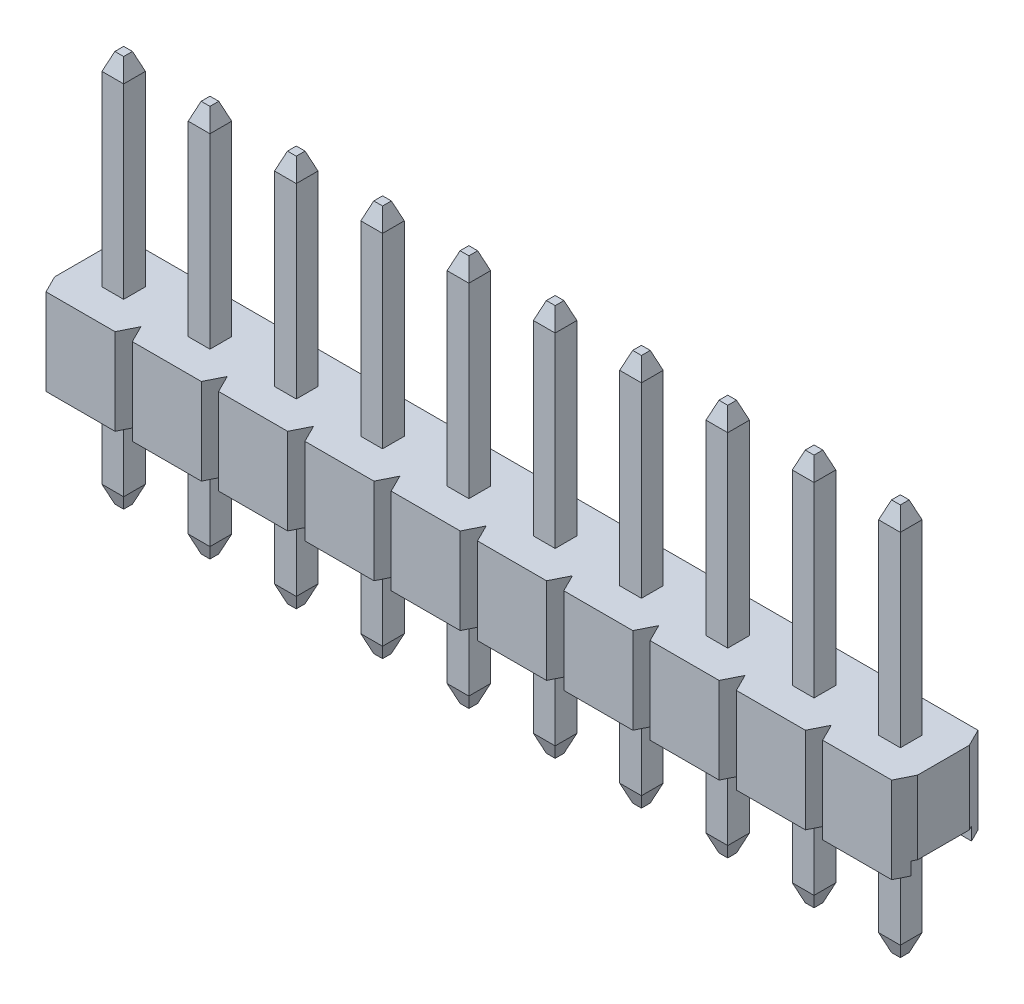
from build123d import *
from OCP.BRepFilletAPI import BRepFilletAPI_MakeChamfer

# Parameters (mm, degrees)
SKETCH1_W                     = 2.54
SKETCH1_H                     = 2.54
MAIN_BODY_DEPTH               = 2.54
SKETCH3_W                     = 1.778
SKETCH3_H                     = 0.381
CUT_EXTRUDE1_DEPTH            = 5.399409051
CUT_EXTRUDE2_DEPTH            = 5.399409051
BODY_PATTERN_COUNT            = 10
BODY_PATTERN_PITCH            = 2.54
PIN_START                     = -5.54
SKETCH2_W                     = 0.64
SKETCH2_H                     = 0.64
PIN_DEPTH                     = 11.54
CHAMFER1_SIZE                 = 0.508
CHAMFER1_SIZE2                = 0.1905
CHAMFER2_SIZE                 = 0.1905
CHAMFER2_SIZE2                = 0.508
PIN_PATTERN_COUNT             = 10
PIN_PATTERN_PITCH             = 2.54
CHAMFER1_OF_PIN_PATTERN_SIZE  = 0.508
CHAMFER1_OF_PIN_PATTERN_SIZE2 = 0.1905
CHAMFER2_OF_PIN_PATTERN_SIZE2 = 0.1905
CHAMFER2_OF_PIN_PATTERN_SIZE  = 0.508


with BuildPart() as part:
    # Sketch1 → Main Body (new body)
    with BuildSketch(Plane(origin=(0, 0, 0), x_dir=(1, 0, 0), z_dir=(0, 1, 0))):
        with Locations((1.27, 1.27)):
            Rectangle(SKETCH1_W, SKETCH1_H)
    main_body = extrude(amount=MAIN_BODY_DEPTH)

    # Sketch3 → Cut-Extrude1 (cut, through all)
    with BuildSketch(Plane.ZY):
        with Locations((-1.27, 0.1905)):
            Rectangle(SKETCH3_W, SKETCH3_H)
    cut_extrude1 = extrude(amount=-CUT_EXTRUDE1_DEPTH, mode=Mode.SUBTRACT)

    # Sketch4 → Cut-Extrude2 (cut, through all)
    with BuildSketch(Plane(origin=(0, 2.54, 0), x_dir=(1, 0, 0), z_dir=(0, 1, 0))):
        Polygon((0.254, 2.54), (0, 2.54), (0, 2.032), align=None)
        Polygon((2.54, 2.54), (2.286, 2.54), (2.54, 2.032), align=None)
        Polygon((0.254, 0), (0, 0.508), (0, 0), align=None)
        Polygon((2.54, 0), (2.286, 0), (2.54, 0.508), align=None)
    cut_extrude2 = extrude(amount=-CUT_EXTRUDE2_DEPTH, mode=Mode.SUBTRACT)

    # Body Pattern: Main Body, Cut-Extrude1, Cut-Extrude2 ×10
    with Locations(*[(-i * BODY_PATTERN_PITCH, 0, 0) for i in range(1, BODY_PATTERN_COUNT)]):
        add(main_body)
        add(cut_extrude1, mode=Mode.SUBTRACT)
        add(cut_extrude2, mode=Mode.SUBTRACT)

    # Sketch2 → Pin (add)
    with BuildSketch(Plane(origin=(0, 2.54, 0), x_dir=(1, 0, 0), z_dir=(0, 1, 0)).offset(PIN_START)):
        with Locations((1.27, 1.27)):
            Rectangle(SKETCH2_W, SKETCH2_H)
    pin = extrude(amount=PIN_DEPTH)

    # Chamfer1: one chamfer whose edges measure the first distance from different faces: ONE call of the kernel's chamfer builder (chamfer() names one face for all edges)
    chamfer1_edges_1 = [part.edges().sort_by_distance(p)[0] for p in [
        (0.95, 8.54, -1.27),
    ]]
    chamfer1_side_1 = [part.faces().sort_by_distance(p)[0] for p in [
        (0.95, 5.54, -1.27),
    ]]
    chamfer1_edges_2 = [part.edges().sort_by_distance(p)[0] for p in [
        (1.27, 8.54, -0.95),
    ]]
    chamfer1_side_2 = [part.faces().sort_by_distance(p)[0] for p in [
        (1.27, 5.54, -0.95),
    ]]
    chamfer1_edges_3 = [part.edges().sort_by_distance(p)[0] for p in [
        (1.59, 8.54, -1.27),
    ]]
    chamfer1_side_3 = [part.faces().sort_by_distance(p)[0] for p in [
        (1.59, 5.54, -1.27),
    ]]
    chamfer1_edges_4 = [part.edges().sort_by_distance(p)[0] for p in [
        (1.27, 8.54, -1.59),
    ]]
    chamfer1_side_4 = [part.faces().sort_by_distance(p)[0] for p in [
        (1.27, 5.54, -1.59),
    ]]
    chamfer1 = BRepFilletAPI_MakeChamfer(part.part.solid().wrapped)
    for e in chamfer1_edges_1:
        chamfer1.Add(CHAMFER1_SIZE, CHAMFER1_SIZE2, e.wrapped, chamfer1_side_1[0].wrapped)  # the first distance lies on this face
    for e in chamfer1_edges_2:
        chamfer1.Add(CHAMFER1_SIZE, CHAMFER1_SIZE2, e.wrapped, chamfer1_side_2[0].wrapped)  # the first distance lies on this face
    for e in chamfer1_edges_3:
        chamfer1.Add(CHAMFER1_SIZE, CHAMFER1_SIZE2, e.wrapped, chamfer1_side_3[0].wrapped)  # the first distance lies on this face
    for e in chamfer1_edges_4:
        chamfer1.Add(CHAMFER1_SIZE, CHAMFER1_SIZE2, e.wrapped, chamfer1_side_4[0].wrapped)  # the first distance lies on this face
    add(Compound.cast(chamfer1.Shape()), mode=Mode.REPLACE)

    # Chamfer2
    chamfer2_edges = [part.edges().sort_by_distance(p)[0] for p in [
        (1.27, -3, -0.95),
        (1.59, -3, -1.27),
        (1.27, -3, -1.59),
        (0.95, -3, -1.27),
    ]]
    chamfer2_side = [part.faces().sort_by_distance(p)[0] for p in [
        (1.27, -3, -1.27),
    ]]
    chamfer(chamfer2_edges, length=CHAMFER2_SIZE, length2=CHAMFER2_SIZE2, reference=chamfer2_side[0])

    # Pin Pattern: Pin ×10
    with Locations(*[(-i * PIN_PATTERN_PITCH, 0, 0) for i in range(1, PIN_PATTERN_COUNT)]):
        add(pin)

    # Chamfer1 of Pin Pattern: one chamfer whose edges measure the first distance from different faces: ONE call of the kernel's chamfer builder (chamfer() names one face for all edges)
    chamfer1_of_pin_pattern_edges_1 = [part.edges().sort_by_distance(p)[0] for p in [
        (-1.59, 8.54, -1.27),
    ]]
    chamfer1_of_pin_pattern_side_1 = [part.faces().sort_by_distance(p)[0] for p in [
        (-1.59, 5.54, -1.27),
    ]]
    chamfer1_of_pin_pattern_edges_2 = [part.edges().sort_by_distance(p)[0] for p in [
        (-1.27, 8.54, -0.95),
    ]]
    chamfer1_of_pin_pattern_side_2 = [part.faces().sort_by_distance(p)[0] for p in [
        (-1.27, 5.54, -0.95),
    ]]
    chamfer1_of_pin_pattern_edges_3 = [part.edges().sort_by_distance(p)[0] for p in [
        (-0.95, 8.54, -1.27),
    ]]
    chamfer1_of_pin_pattern_side_3 = [part.faces().sort_by_distance(p)[0] for p in [
        (-0.95, 5.54, -1.27),
    ]]
    chamfer1_of_pin_pattern_edges_4 = [part.edges().sort_by_distance(p)[0] for p in [
        (-1.27, 8.54, -1.59),
    ]]
    chamfer1_of_pin_pattern_side_4 = [part.faces().sort_by_distance(p)[0] for p in [
        (-1.27, 5.54, -1.59),
    ]]
    chamfer1_of_pin_pattern_edges_5 = [part.edges().sort_by_distance(p)[0] for p in [
        (-4.13, 8.54, -1.27),
    ]]
    chamfer1_of_pin_pattern_side_5 = [part.faces().sort_by_distance(p)[0] for p in [
        (-4.13, 5.54, -1.27),
    ]]
    chamfer1_of_pin_pattern_edges_6 = [part.edges().sort_by_distance(p)[0] for p in [
        (-3.81, 8.54, -0.95),
    ]]
    chamfer1_of_pin_pattern_side_6 = [part.faces().sort_by_distance(p)[0] for p in [
        (-3.81, 5.54, -0.95),
    ]]
    chamfer1_of_pin_pattern_edges_7 = [part.edges().sort_by_distance(p)[0] for p in [
        (-3.49, 8.54, -1.27),
    ]]
    chamfer1_of_pin_pattern_side_7 = [part.faces().sort_by_distance(p)[0] for p in [
        (-3.49, 5.54, -1.27),
    ]]
    chamfer1_of_pin_pattern_edges_8 = [part.edges().sort_by_distance(p)[0] for p in [
        (-3.81, 8.54, -1.59),
    ]]
    chamfer1_of_pin_pattern_side_8 = [part.faces().sort_by_distance(p)[0] for p in [
        (-3.81, 5.54, -1.59),
    ]]
    chamfer1_of_pin_pattern_edges_9 = [part.edges().sort_by_distance(p)[0] for p in [
        (-6.67, 8.54, -1.27),
    ]]
    chamfer1_of_pin_pattern_side_9 = [part.faces().sort_by_distance(p)[0] for p in [
        (-6.67, 5.54, -1.27),
    ]]
    chamfer1_of_pin_pattern_edges_10 = [part.edges().sort_by_distance(p)[0] for p in [
        (-6.35, 8.54, -0.95),
    ]]
    chamfer1_of_pin_pattern_side_10 = [part.faces().sort_by_distance(p)[0] for p in [
        (-6.35, 5.54, -0.95),
    ]]
    chamfer1_of_pin_pattern_edges_11 = [part.edges().sort_by_distance(p)[0] for p in [
        (-6.03, 8.54, -1.27),
    ]]
    chamfer1_of_pin_pattern_side_11 = [part.faces().sort_by_distance(p)[0] for p in [
        (-6.03, 5.54, -1.27),
    ]]
    chamfer1_of_pin_pattern_edges_12 = [part.edges().sort_by_distance(p)[0] for p in [
        (-6.35, 8.54, -1.59),
    ]]
    chamfer1_of_pin_pattern_side_12 = [part.faces().sort_by_distance(p)[0] for p in [
        (-6.35, 5.54, -1.59),
    ]]
    chamfer1_of_pin_pattern_edges_13 = [part.edges().sort_by_distance(p)[0] for p in [
        (-9.21, 8.54, -1.27),
    ]]
    chamfer1_of_pin_pattern_side_13 = [part.faces().sort_by_distance(p)[0] for p in [
        (-9.21, 5.54, -1.27),
    ]]
    chamfer1_of_pin_pattern_edges_14 = [part.edges().sort_by_distance(p)[0] for p in [
        (-8.89, 8.54, -0.95),
    ]]
    chamfer1_of_pin_pattern_side_14 = [part.faces().sort_by_distance(p)[0] for p in [
        (-8.89, 5.54, -0.95),
    ]]
    chamfer1_of_pin_pattern_edges_15 = [part.edges().sort_by_distance(p)[0] for p in [
        (-8.57, 8.54, -1.27),
    ]]
    chamfer1_of_pin_pattern_side_15 = [part.faces().sort_by_distance(p)[0] for p in [
        (-8.57, 5.54, -1.27),
    ]]
    chamfer1_of_pin_pattern_edges_16 = [part.edges().sort_by_distance(p)[0] for p in [
        (-8.89, 8.54, -1.59),
    ]]
    chamfer1_of_pin_pattern_side_16 = [part.faces().sort_by_distance(p)[0] for p in [
        (-8.89, 5.54, -1.59),
    ]]
    chamfer1_of_pin_pattern_edges_17 = [part.edges().sort_by_distance(p)[0] for p in [
        (-11.75, 8.54, -1.27),
    ]]
    chamfer1_of_pin_pattern_side_17 = [part.faces().sort_by_distance(p)[0] for p in [
        (-11.75, 5.54, -1.27),
    ]]
    chamfer1_of_pin_pattern_edges_18 = [part.edges().sort_by_distance(p)[0] for p in [
        (-11.43, 8.54, -0.95),
    ]]
    chamfer1_of_pin_pattern_side_18 = [part.faces().sort_by_distance(p)[0] for p in [
        (-11.43, 5.54, -0.95),
    ]]
    chamfer1_of_pin_pattern_edges_19 = [part.edges().sort_by_distance(p)[0] for p in [
        (-11.11, 8.54, -1.27),
    ]]
    chamfer1_of_pin_pattern_side_19 = [part.faces().sort_by_distance(p)[0] for p in [
        (-11.11, 5.54, -1.27),
    ]]
    chamfer1_of_pin_pattern_edges_20 = [part.edges().sort_by_distance(p)[0] for p in [
        (-11.43, 8.54, -1.59),
    ]]
    chamfer1_of_pin_pattern_side_20 = [part.faces().sort_by_distance(p)[0] for p in [
        (-11.43, 5.54, -1.59),
    ]]
    chamfer1_of_pin_pattern_edges_21 = [part.edges().sort_by_distance(p)[0] for p in [
        (-14.29, 8.54, -1.27),
    ]]
    chamfer1_of_pin_pattern_side_21 = [part.faces().sort_by_distance(p)[0] for p in [
        (-14.29, 5.54, -1.27),
    ]]
    chamfer1_of_pin_pattern_edges_22 = [part.edges().sort_by_distance(p)[0] for p in [
        (-13.97, 8.54, -0.95),
    ]]
    chamfer1_of_pin_pattern_side_22 = [part.faces().sort_by_distance(p)[0] for p in [
        (-13.97, 5.54, -0.95),
    ]]
    chamfer1_of_pin_pattern_edges_23 = [part.edges().sort_by_distance(p)[0] for p in [
        (-13.65, 8.54, -1.27),
    ]]
    chamfer1_of_pin_pattern_side_23 = [part.faces().sort_by_distance(p)[0] for p in [
        (-13.65, 5.54, -1.27),
    ]]
    chamfer1_of_pin_pattern_edges_24 = [part.edges().sort_by_distance(p)[0] for p in [
        (-13.97, 8.54, -1.59),
    ]]
    chamfer1_of_pin_pattern_side_24 = [part.faces().sort_by_distance(p)[0] for p in [
        (-13.97, 5.54, -1.59),
    ]]
    chamfer1_of_pin_pattern_edges_25 = [part.edges().sort_by_distance(p)[0] for p in [
        (-16.83, 8.54, -1.27),
    ]]
    chamfer1_of_pin_pattern_side_25 = [part.faces().sort_by_distance(p)[0] for p in [
        (-16.83, 5.54, -1.27),
    ]]
    chamfer1_of_pin_pattern_edges_26 = [part.edges().sort_by_distance(p)[0] for p in [
        (-16.51, 8.54, -0.95),
    ]]
    chamfer1_of_pin_pattern_side_26 = [part.faces().sort_by_distance(p)[0] for p in [
        (-16.51, 5.54, -0.95),
    ]]
    chamfer1_of_pin_pattern_edges_27 = [part.edges().sort_by_distance(p)[0] for p in [
        (-16.19, 8.54, -1.27),
    ]]
    chamfer1_of_pin_pattern_side_27 = [part.faces().sort_by_distance(p)[0] for p in [
        (-16.19, 5.54, -1.27),
    ]]
    chamfer1_of_pin_pattern_edges_28 = [part.edges().sort_by_distance(p)[0] for p in [
        (-16.51, 8.54, -1.59),
    ]]
    chamfer1_of_pin_pattern_side_28 = [part.faces().sort_by_distance(p)[0] for p in [
        (-16.51, 5.54, -1.59),
    ]]
    chamfer1_of_pin_pattern_edges_29 = [part.edges().sort_by_distance(p)[0] for p in [
        (-19.37, 8.54, -1.27),
    ]]
    chamfer1_of_pin_pattern_side_29 = [part.faces().sort_by_distance(p)[0] for p in [
        (-19.37, 5.54, -1.27),
    ]]
    chamfer1_of_pin_pattern_edges_30 = [part.edges().sort_by_distance(p)[0] for p in [
        (-19.05, 8.54, -0.95),
    ]]
    chamfer1_of_pin_pattern_side_30 = [part.faces().sort_by_distance(p)[0] for p in [
        (-19.05, 5.54, -0.95),
    ]]
    chamfer1_of_pin_pattern_edges_31 = [part.edges().sort_by_distance(p)[0] for p in [
        (-18.73, 8.54, -1.27),
    ]]
    chamfer1_of_pin_pattern_side_31 = [part.faces().sort_by_distance(p)[0] for p in [
        (-18.73, 5.54, -1.27),
    ]]
    chamfer1_of_pin_pattern_edges_32 = [part.edges().sort_by_distance(p)[0] for p in [
        (-19.05, 8.54, -1.59),
    ]]
    chamfer1_of_pin_pattern_side_32 = [part.faces().sort_by_distance(p)[0] for p in [
        (-19.05, 5.54, -1.59),
    ]]
    chamfer1_of_pin_pattern_edges_33 = [part.edges().sort_by_distance(p)[0] for p in [
        (-21.91, 8.54, -1.27),
    ]]
    chamfer1_of_pin_pattern_side_33 = [part.faces().sort_by_distance(p)[0] for p in [
        (-21.91, 5.54, -1.27),
    ]]
    chamfer1_of_pin_pattern_edges_34 = [part.edges().sort_by_distance(p)[0] for p in [
        (-21.59, 8.54, -0.95),
    ]]
    chamfer1_of_pin_pattern_side_34 = [part.faces().sort_by_distance(p)[0] for p in [
        (-21.59, 5.54, -0.95),
    ]]
    chamfer1_of_pin_pattern_edges_35 = [part.edges().sort_by_distance(p)[0] for p in [
        (-21.27, 8.54, -1.27),
    ]]
    chamfer1_of_pin_pattern_side_35 = [part.faces().sort_by_distance(p)[0] for p in [
        (-21.27, 5.54, -1.27),
    ]]
    chamfer1_of_pin_pattern_edges_36 = [part.edges().sort_by_distance(p)[0] for p in [
        (-21.59, 8.54, -1.59),
    ]]
    chamfer1_of_pin_pattern_side_36 = [part.faces().sort_by_distance(p)[0] for p in [
        (-21.59, 5.54, -1.59),
    ]]
    chamfer1_of_pin_pattern = BRepFilletAPI_MakeChamfer(part.part.solid().wrapped)
    for e in chamfer1_of_pin_pattern_edges_1:
        chamfer1_of_pin_pattern.Add(CHAMFER1_OF_PIN_PATTERN_SIZE, CHAMFER1_OF_PIN_PATTERN_SIZE2, e.wrapped, chamfer1_of_pin_pattern_side_1[0].wrapped)  # the first distance lies on this face
    for e in chamfer1_of_pin_pattern_edges_2:
        chamfer1_of_pin_pattern.Add(CHAMFER1_OF_PIN_PATTERN_SIZE, CHAMFER1_OF_PIN_PATTERN_SIZE2, e.wrapped, chamfer1_of_pin_pattern_side_2[0].wrapped)  # the first distance lies on this face
    for e in chamfer1_of_pin_pattern_edges_3:
        chamfer1_of_pin_pattern.Add(CHAMFER1_OF_PIN_PATTERN_SIZE, CHAMFER1_OF_PIN_PATTERN_SIZE2, e.wrapped, chamfer1_of_pin_pattern_side_3[0].wrapped)  # the first distance lies on this face
    for e in chamfer1_of_pin_pattern_edges_4:
        chamfer1_of_pin_pattern.Add(CHAMFER1_OF_PIN_PATTERN_SIZE, CHAMFER1_OF_PIN_PATTERN_SIZE2, e.wrapped, chamfer1_of_pin_pattern_side_4[0].wrapped)  # the first distance lies on this face
    for e in chamfer1_of_pin_pattern_edges_5:
        chamfer1_of_pin_pattern.Add(CHAMFER1_OF_PIN_PATTERN_SIZE, CHAMFER1_OF_PIN_PATTERN_SIZE2, e.wrapped, chamfer1_of_pin_pattern_side_5[0].wrapped)  # the first distance lies on this face
    for e in chamfer1_of_pin_pattern_edges_6:
        chamfer1_of_pin_pattern.Add(CHAMFER1_OF_PIN_PATTERN_SIZE, CHAMFER1_OF_PIN_PATTERN_SIZE2, e.wrapped, chamfer1_of_pin_pattern_side_6[0].wrapped)  # the first distance lies on this face
    for e in chamfer1_of_pin_pattern_edges_7:
        chamfer1_of_pin_pattern.Add(CHAMFER1_OF_PIN_PATTERN_SIZE, CHAMFER1_OF_PIN_PATTERN_SIZE2, e.wrapped, chamfer1_of_pin_pattern_side_7[0].wrapped)  # the first distance lies on this face
    for e in chamfer1_of_pin_pattern_edges_8:
        chamfer1_of_pin_pattern.Add(CHAMFER1_OF_PIN_PATTERN_SIZE, CHAMFER1_OF_PIN_PATTERN_SIZE2, e.wrapped, chamfer1_of_pin_pattern_side_8[0].wrapped)  # the first distance lies on this face
    for e in chamfer1_of_pin_pattern_edges_9:
        chamfer1_of_pin_pattern.Add(CHAMFER1_OF_PIN_PATTERN_SIZE, CHAMFER1_OF_PIN_PATTERN_SIZE2, e.wrapped, chamfer1_of_pin_pattern_side_9[0].wrapped)  # the first distance lies on this face
    for e in chamfer1_of_pin_pattern_edges_10:
        chamfer1_of_pin_pattern.Add(CHAMFER1_OF_PIN_PATTERN_SIZE, CHAMFER1_OF_PIN_PATTERN_SIZE2, e.wrapped, chamfer1_of_pin_pattern_side_10[0].wrapped)  # the first distance lies on this face
    for e in chamfer1_of_pin_pattern_edges_11:
        chamfer1_of_pin_pattern.Add(CHAMFER1_OF_PIN_PATTERN_SIZE, CHAMFER1_OF_PIN_PATTERN_SIZE2, e.wrapped, chamfer1_of_pin_pattern_side_11[0].wrapped)  # the first distance lies on this face
    for e in chamfer1_of_pin_pattern_edges_12:
        chamfer1_of_pin_pattern.Add(CHAMFER1_OF_PIN_PATTERN_SIZE, CHAMFER1_OF_PIN_PATTERN_SIZE2, e.wrapped, chamfer1_of_pin_pattern_side_12[0].wrapped)  # the first distance lies on this face
    for e in chamfer1_of_pin_pattern_edges_13:
        chamfer1_of_pin_pattern.Add(CHAMFER1_OF_PIN_PATTERN_SIZE, CHAMFER1_OF_PIN_PATTERN_SIZE2, e.wrapped, chamfer1_of_pin_pattern_side_13[0].wrapped)  # the first distance lies on this face
    for e in chamfer1_of_pin_pattern_edges_14:
        chamfer1_of_pin_pattern.Add(CHAMFER1_OF_PIN_PATTERN_SIZE, CHAMFER1_OF_PIN_PATTERN_SIZE2, e.wrapped, chamfer1_of_pin_pattern_side_14[0].wrapped)  # the first distance lies on this face
    for e in chamfer1_of_pin_pattern_edges_15:
        chamfer1_of_pin_pattern.Add(CHAMFER1_OF_PIN_PATTERN_SIZE, CHAMFER1_OF_PIN_PATTERN_SIZE2, e.wrapped, chamfer1_of_pin_pattern_side_15[0].wrapped)  # the first distance lies on this face
    for e in chamfer1_of_pin_pattern_edges_16:
        chamfer1_of_pin_pattern.Add(CHAMFER1_OF_PIN_PATTERN_SIZE, CHAMFER1_OF_PIN_PATTERN_SIZE2, e.wrapped, chamfer1_of_pin_pattern_side_16[0].wrapped)  # the first distance lies on this face
    for e in chamfer1_of_pin_pattern_edges_17:
        chamfer1_of_pin_pattern.Add(CHAMFER1_OF_PIN_PATTERN_SIZE, CHAMFER1_OF_PIN_PATTERN_SIZE2, e.wrapped, chamfer1_of_pin_pattern_side_17[0].wrapped)  # the first distance lies on this face
    for e in chamfer1_of_pin_pattern_edges_18:
        chamfer1_of_pin_pattern.Add(CHAMFER1_OF_PIN_PATTERN_SIZE, CHAMFER1_OF_PIN_PATTERN_SIZE2, e.wrapped, chamfer1_of_pin_pattern_side_18[0].wrapped)  # the first distance lies on this face
    for e in chamfer1_of_pin_pattern_edges_19:
        chamfer1_of_pin_pattern.Add(CHAMFER1_OF_PIN_PATTERN_SIZE, CHAMFER1_OF_PIN_PATTERN_SIZE2, e.wrapped, chamfer1_of_pin_pattern_side_19[0].wrapped)  # the first distance lies on this face
    for e in chamfer1_of_pin_pattern_edges_20:
        chamfer1_of_pin_pattern.Add(CHAMFER1_OF_PIN_PATTERN_SIZE, CHAMFER1_OF_PIN_PATTERN_SIZE2, e.wrapped, chamfer1_of_pin_pattern_side_20[0].wrapped)  # the first distance lies on this face
    for e in chamfer1_of_pin_pattern_edges_21:
        chamfer1_of_pin_pattern.Add(CHAMFER1_OF_PIN_PATTERN_SIZE, CHAMFER1_OF_PIN_PATTERN_SIZE2, e.wrapped, chamfer1_of_pin_pattern_side_21[0].wrapped)  # the first distance lies on this face
    for e in chamfer1_of_pin_pattern_edges_22:
        chamfer1_of_pin_pattern.Add(CHAMFER1_OF_PIN_PATTERN_SIZE, CHAMFER1_OF_PIN_PATTERN_SIZE2, e.wrapped, chamfer1_of_pin_pattern_side_22[0].wrapped)  # the first distance lies on this face
    for e in chamfer1_of_pin_pattern_edges_23:
        chamfer1_of_pin_pattern.Add(CHAMFER1_OF_PIN_PATTERN_SIZE, CHAMFER1_OF_PIN_PATTERN_SIZE2, e.wrapped, chamfer1_of_pin_pattern_side_23[0].wrapped)  # the first distance lies on this face
    for e in chamfer1_of_pin_pattern_edges_24:
        chamfer1_of_pin_pattern.Add(CHAMFER1_OF_PIN_PATTERN_SIZE, CHAMFER1_OF_PIN_PATTERN_SIZE2, e.wrapped, chamfer1_of_pin_pattern_side_24[0].wrapped)  # the first distance lies on this face
    for e in chamfer1_of_pin_pattern_edges_25:
        chamfer1_of_pin_pattern.Add(CHAMFER1_OF_PIN_PATTERN_SIZE, CHAMFER1_OF_PIN_PATTERN_SIZE2, e.wrapped, chamfer1_of_pin_pattern_side_25[0].wrapped)  # the first distance lies on this face
    for e in chamfer1_of_pin_pattern_edges_26:
        chamfer1_of_pin_pattern.Add(CHAMFER1_OF_PIN_PATTERN_SIZE, CHAMFER1_OF_PIN_PATTERN_SIZE2, e.wrapped, chamfer1_of_pin_pattern_side_26[0].wrapped)  # the first distance lies on this face
    for e in chamfer1_of_pin_pattern_edges_27:
        chamfer1_of_pin_pattern.Add(CHAMFER1_OF_PIN_PATTERN_SIZE, CHAMFER1_OF_PIN_PATTERN_SIZE2, e.wrapped, chamfer1_of_pin_pattern_side_27[0].wrapped)  # the first distance lies on this face
    for e in chamfer1_of_pin_pattern_edges_28:
        chamfer1_of_pin_pattern.Add(CHAMFER1_OF_PIN_PATTERN_SIZE, CHAMFER1_OF_PIN_PATTERN_SIZE2, e.wrapped, chamfer1_of_pin_pattern_side_28[0].wrapped)  # the first distance lies on this face
    for e in chamfer1_of_pin_pattern_edges_29:
        chamfer1_of_pin_pattern.Add(CHAMFER1_OF_PIN_PATTERN_SIZE, CHAMFER1_OF_PIN_PATTERN_SIZE2, e.wrapped, chamfer1_of_pin_pattern_side_29[0].wrapped)  # the first distance lies on this face
    for e in chamfer1_of_pin_pattern_edges_30:
        chamfer1_of_pin_pattern.Add(CHAMFER1_OF_PIN_PATTERN_SIZE, CHAMFER1_OF_PIN_PATTERN_SIZE2, e.wrapped, chamfer1_of_pin_pattern_side_30[0].wrapped)  # the first distance lies on this face
    for e in chamfer1_of_pin_pattern_edges_31:
        chamfer1_of_pin_pattern.Add(CHAMFER1_OF_PIN_PATTERN_SIZE, CHAMFER1_OF_PIN_PATTERN_SIZE2, e.wrapped, chamfer1_of_pin_pattern_side_31[0].wrapped)  # the first distance lies on this face
    for e in chamfer1_of_pin_pattern_edges_32:
        chamfer1_of_pin_pattern.Add(CHAMFER1_OF_PIN_PATTERN_SIZE, CHAMFER1_OF_PIN_PATTERN_SIZE2, e.wrapped, chamfer1_of_pin_pattern_side_32[0].wrapped)  # the first distance lies on this face
    for e in chamfer1_of_pin_pattern_edges_33:
        chamfer1_of_pin_pattern.Add(CHAMFER1_OF_PIN_PATTERN_SIZE, CHAMFER1_OF_PIN_PATTERN_SIZE2, e.wrapped, chamfer1_of_pin_pattern_side_33[0].wrapped)  # the first distance lies on this face
    for e in chamfer1_of_pin_pattern_edges_34:
        chamfer1_of_pin_pattern.Add(CHAMFER1_OF_PIN_PATTERN_SIZE, CHAMFER1_OF_PIN_PATTERN_SIZE2, e.wrapped, chamfer1_of_pin_pattern_side_34[0].wrapped)  # the first distance lies on this face
    for e in chamfer1_of_pin_pattern_edges_35:
        chamfer1_of_pin_pattern.Add(CHAMFER1_OF_PIN_PATTERN_SIZE, CHAMFER1_OF_PIN_PATTERN_SIZE2, e.wrapped, chamfer1_of_pin_pattern_side_35[0].wrapped)  # the first distance lies on this face
    for e in chamfer1_of_pin_pattern_edges_36:
        chamfer1_of_pin_pattern.Add(CHAMFER1_OF_PIN_PATTERN_SIZE, CHAMFER1_OF_PIN_PATTERN_SIZE2, e.wrapped, chamfer1_of_pin_pattern_side_36[0].wrapped)  # the first distance lies on this face
    add(Compound.cast(chamfer1_of_pin_pattern.Shape()), mode=Mode.REPLACE)

    # Chamfer2 of Pin Pattern
    chamfer2_of_pin_pattern_edges = [part.edges().sort_by_distance(p)[0] for p in [
        (-1.27, -3, -0.95),
        (-0.95, -3, -1.27),
        (-1.27, -3, -1.59),
        (-1.59, -3, -1.27),
        (-3.81, -3, -0.95),
        (-3.49, -3, -1.27),
        (-3.81, -3, -1.59),
        (-4.13, -3, -1.27),
        (-6.35, -3, -0.95),
        (-6.03, -3, -1.27),
        (-6.35, -3, -1.59),
        (-6.67, -3, -1.27),
        (-8.89, -3, -0.95),
        (-8.57, -3, -1.27),
        (-8.89, -3, -1.59),
        (-9.21, -3, -1.27),
        (-11.43, -3, -0.95),
        (-11.11, -3, -1.27),
        (-11.43, -3, -1.59),
        (-11.75, -3, -1.27),
        (-13.97, -3, -0.95),
        (-13.65, -3, -1.27),
        (-13.97, -3, -1.59),
        (-14.29, -3, -1.27),
        (-16.51, -3, -0.95),
        (-16.19, -3, -1.27),
        (-16.51, -3, -1.59),
        (-16.83, -3, -1.27),
        (-19.05, -3, -0.95),
        (-18.73, -3, -1.27),
        (-19.05, -3, -1.59),
        (-19.37, -3, -1.27),
        (-21.59, -3, -0.95),
        (-21.27, -3, -1.27),
        (-21.59, -3, -1.59),
        (-21.91, -3, -1.27),
    ]]
    chamfer(chamfer2_of_pin_pattern_edges, length=CHAMFER2_OF_PIN_PATTERN_SIZE, length2=CHAMFER2_OF_PIN_PATTERN_SIZE2)


solid = part.part
